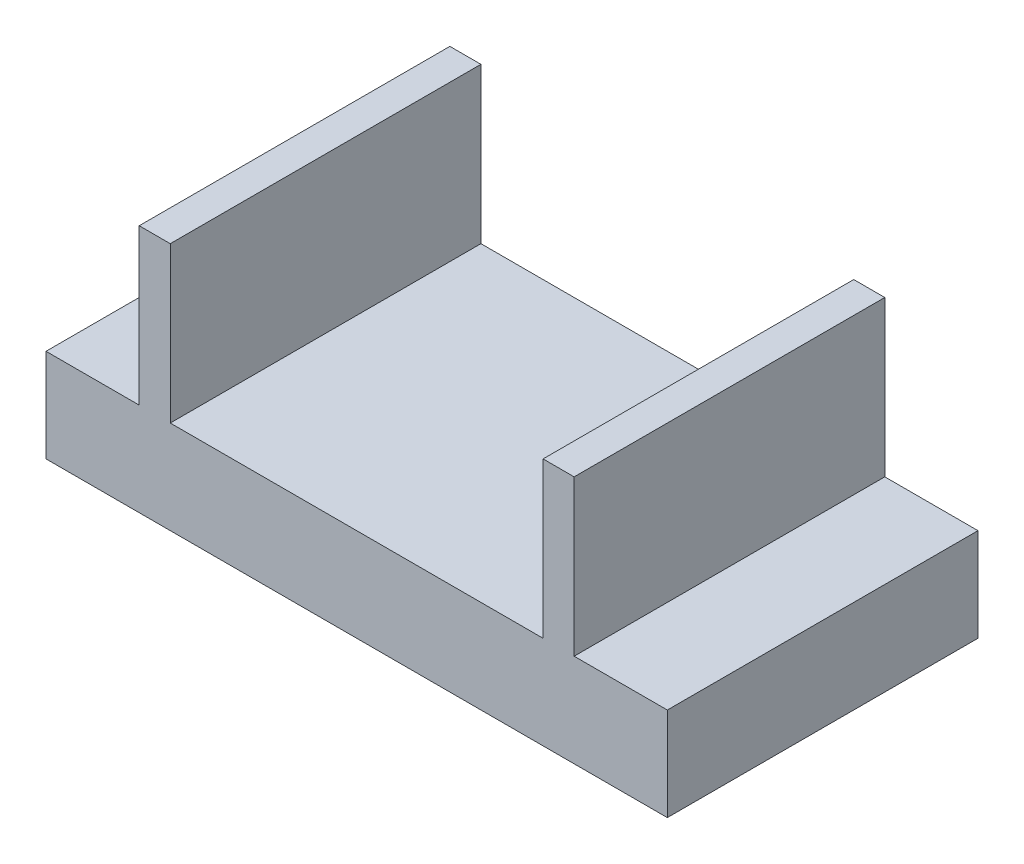
from build123d import *

# Parameters (mm, degrees)
EXTRUDE_1_DEPTH = 10


with BuildPart() as part:
    # Эскиз1 → Бобышка-Вытянуть1 (new body)
    with BuildSketch(Plane.XY):
        Polygon((0, 0), (20, 0), (20, 3), (17, 3), (17, 8), (16, 8), (16, 3), (4, 3), (4, 8), (3, 8), (3, 3), (0, 3), align=None)
    extrude(amount=EXTRUDE_1_DEPTH)


solid = part.part
